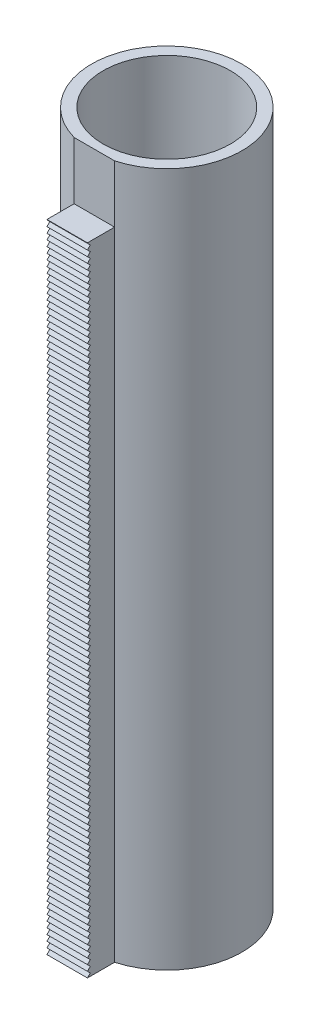
from build123d import *

# Parameters (mm, degrees)
CROQUIS1_R              = 11
SALIENTE_EXTRUIR1_DEPTH = 120
CORTAR_EXTRUIR1_DEPTH   = 120
MATRIZL1_COUNT          = 120
MATRIZL1_PITCH          = 1
CROQUIS4_W              = 4.7
CROQUIS4_H              = 9.923199762
CORTAR_EXTRUIR2_DEPTH   = 120


with BuildPart() as part:
    # Croquis1 → Saliente-Extruir1 (new body)
    with BuildSketch(Plane(origin=(0, 0, 0), x_dir=(1, 0, 0), z_dir=(0, 1, 0))):
        with BuildLine():
            Line((-3.5, -12.519984026), (-3.5, -17.219984026))
            Line((-3.5, -17.219984026), (3.5, -17.219984026))
            Line((3.5, -17.219984026), (3.5, -12.519984026))
            ThreePointArc((3.5, -12.519984026), (0, 13), (-3.5, -12.519984026))
        make_face()
        with Locations(Location((0, 0, 0), (0, 0, 270))):
            Circle(CROQUIS1_R, mode=Mode.SUBTRACT)
    extrude(amount=SALIENTE_EXTRUIR1_DEPTH)

    # Croquis3 → Cortar-Extruir1 (cut)
    with BuildSketch(Plane(origin=(3.5, 0, 0), x_dir=(0, 0, -1), z_dir=(1, 0, 0))):
        Polygon((-17.219984026, 109), (-16.719984026, 109.5), (-17.219984026, 109.5), align=None)
        Polygon((-16.719984026, 109.5), (-17.219984026, 110), (-17.219984026, 109.5), align=None)
    cortar_extruir1 = extrude(amount=-CORTAR_EXTRUIR1_DEPTH, mode=Mode.SUBTRACT)

    # MatrizL1: Cortar-Extruir1 ×120
    with Locations(*[(0, -i * MATRIZL1_PITCH, 0) for i in range(1, MATRIZL1_COUNT)]):
        add(cortar_extruir1, mode=Mode.SUBTRACT)

    # Croquis4 → Cortar-Extruir2 (cut)
    with BuildSketch(Plane(origin=(3.5, 0, 0), x_dir=(0, 0, -1), z_dir=(1, 0, 0))):
        with Locations((-14.869984026, 115.038400119)):
            Rectangle(CROQUIS4_W, CROQUIS4_H)
    extrude(amount=-CORTAR_EXTRUIR2_DEPTH, mode=Mode.SUBTRACT)


solid = part.part
